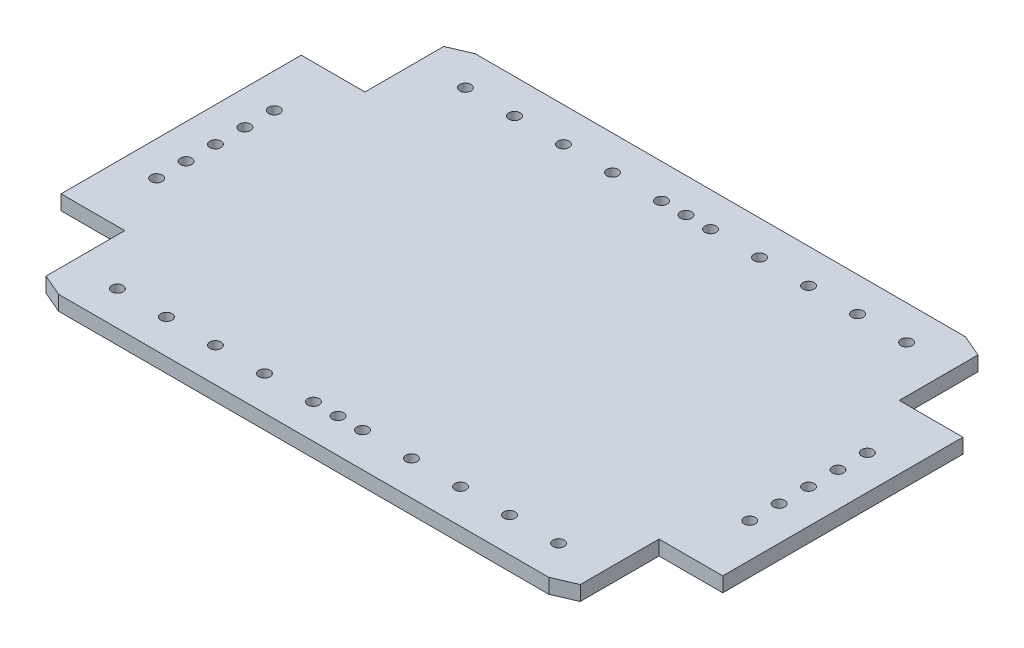
from build123d import *

# Parameters (mm, degrees)
BOSS_EXTRU_1_DEPTH       = 6
ENL_V_MAT_EXTRU_6_REACH  = 161.643
ESQUISSE15_R             = 2.3
ENL_V_MAT_EXTRU_7_REACH  = 161.643
ESQUISSE17_R             = 2.3
ENL_V_MAT_EXTRU_10_REACH = 161.643
SYM_TRIE8_COPY_1_REACH   = 161.643
ENL_V_MAT_EXTRU_11_REACH = 161.643
ESQUISSE21_R             = 2.3


with BuildPart() as part:
    # Esquisse1 → Boss.-Extru.1 (new body)
    with BuildSketch(Plane(origin=(0, 0, 0), x_dir=(1, 0, 0), z_dir=(0, 1, 0))):
        Polygon((-135, 0), (-135, -70), (-100, -85), (0, -85), (100, -85), (135, -70), (135, 0), (135, 70), (100, 85), (0, 85), (-100, 85), (-135, 70), align=None)
    extrude(amount=BOSS_EXTRU_1_DEPTH)

    # Esquisse15 → Enlèv. mat.-Extru.6 (cut, up to next)
    with BuildSketch(Plane(origin=(0, 6, 0), x_dir=(1, 0, 0), z_dir=(0, 1, 0)), mode=Mode.PRIVATE) as enl_v_mat_extru_6_sk1:
        with Locations(Location((-120, -60, 0), (0, 0, 270))):
            Circle(ESQUISSE15_R)
    enl_v_mat_extru_6_tool1 = extrude(enl_v_mat_extru_6_sk1.sketch, amount=-ENL_V_MAT_EXTRU_6_REACH, mode=Mode.PRIVATE) & part.part
    # Esquisse15 → Enlèv. mat.-Extru.6 (cut, up to next)
    with BuildSketch(Plane(origin=(0, 6, 0), x_dir=(1, 0, 0), z_dir=(0, 1, 0)), mode=Mode.PRIVATE) as enl_v_mat_extru_6_sk2:
        with Locations(Location((-120, 60, 0), (0, 0, 270))):
            Circle(ESQUISSE15_R)
    enl_v_mat_extru_6_tool2 = extrude(enl_v_mat_extru_6_sk2.sketch, amount=-ENL_V_MAT_EXTRU_6_REACH, mode=Mode.PRIVATE) & part.part
    enl_v_mat_extru_6_1 = enl_v_mat_extru_6_tool1.solids().sort_by_distance((-120, 6, 60))[0]
    add(enl_v_mat_extru_6_1, mode=Mode.SUBTRACT)
    enl_v_mat_extru_6_2 = enl_v_mat_extru_6_tool2.solids().sort_by_distance((-120, 6, -60))[0]
    add(enl_v_mat_extru_6_2, mode=Mode.SUBTRACT)
    enl_v_mat_extru_6 = enl_v_mat_extru_6_1 + enl_v_mat_extru_6_2  # Enlèv. mat.-Extru.6 as one shape, for the pattern or mirror that repeats it

    # Symétrie5: Enlèv. mat.-Extru.6 across plane
    add(enl_v_mat_extru_6.mirror(Plane(origin=(0, 0, 0), x_dir=(0, 0, 1), z_dir=(1, 0, 0))), mode=Mode.SUBTRACT)

    # Esquisse17 → Enlèv. mat.-Extru.7 (cut, up to next)
    with BuildSketch(Plane(origin=(0, 6, 0), x_dir=(1, 0, 0), z_dir=(0, 1, 0)), mode=Mode.PRIVATE) as enl_v_mat_extru_7_sk1:
        with Locations(Location((0, -71, 0), (0, 0, 270))):
            Circle(ESQUISSE17_R)
    enl_v_mat_extru_7_tool1 = extrude(enl_v_mat_extru_7_sk1.sketch, amount=-ENL_V_MAT_EXTRU_7_REACH, mode=Mode.PRIVATE) & part.part
    # Esquisse17 → Enlèv. mat.-Extru.7 (cut, up to next)
    with BuildSketch(Plane(origin=(0, 6, 0), x_dir=(1, 0, 0), z_dir=(0, 1, 0)), mode=Mode.PRIVATE) as enl_v_mat_extru_7_sk2:
        with Locations(Location((10, -71, 0), (0, 0, 270))):
            Circle(ESQUISSE17_R)
    enl_v_mat_extru_7_tool2 = extrude(enl_v_mat_extru_7_sk2.sketch, amount=-ENL_V_MAT_EXTRU_7_REACH, mode=Mode.PRIVATE) & part.part
    # Esquisse17 → Enlèv. mat.-Extru.7 (cut, up to next)
    with BuildSketch(Plane(origin=(0, 6, 0), x_dir=(1, 0, 0), z_dir=(0, 1, 0)), mode=Mode.PRIVATE) as enl_v_mat_extru_7_sk3:
        with Locations(Location((-10, -71, 0), (0, 0, 270))):
            Circle(ESQUISSE17_R)
    enl_v_mat_extru_7_tool3 = extrude(enl_v_mat_extru_7_sk3.sketch, amount=-ENL_V_MAT_EXTRU_7_REACH, mode=Mode.PRIVATE) & part.part
    # Esquisse17 → Enlèv. mat.-Extru.7 (cut, up to next)
    with BuildSketch(Plane(origin=(0, 6, 0), x_dir=(1, 0, 0), z_dir=(0, 1, 0)), mode=Mode.PRIVATE) as enl_v_mat_extru_7_sk4:
        with Locations(Location((30, -71, 0), (0, 0, 270))):
            Circle(ESQUISSE17_R)
    enl_v_mat_extru_7_tool4 = extrude(enl_v_mat_extru_7_sk4.sketch, amount=-ENL_V_MAT_EXTRU_7_REACH, mode=Mode.PRIVATE) & part.part
    # Esquisse17 → Enlèv. mat.-Extru.7 (cut, up to next)
    with BuildSketch(Plane(origin=(0, 6, 0), x_dir=(1, 0, 0), z_dir=(0, 1, 0)), mode=Mode.PRIVATE) as enl_v_mat_extru_7_sk5:
        with Locations(Location((50, -71, 0), (0, 0, 270))):
            Circle(ESQUISSE17_R)
    enl_v_mat_extru_7_tool5 = extrude(enl_v_mat_extru_7_sk5.sketch, amount=-ENL_V_MAT_EXTRU_7_REACH, mode=Mode.PRIVATE) & part.part
    # Esquisse17 → Enlèv. mat.-Extru.7 (cut, up to next)
    with BuildSketch(Plane(origin=(0, 6, 0), x_dir=(1, 0, 0), z_dir=(0, 1, 0)), mode=Mode.PRIVATE) as enl_v_mat_extru_7_sk6:
        with Locations(Location((90, -71, 0), (0, 0, 270))):
            Circle(ESQUISSE17_R)
    enl_v_mat_extru_7_tool6 = extrude(enl_v_mat_extru_7_sk6.sketch, amount=-ENL_V_MAT_EXTRU_7_REACH, mode=Mode.PRIVATE) & part.part
    # Esquisse17 → Enlèv. mat.-Extru.7 (cut, up to next)
    with BuildSketch(Plane(origin=(0, 6, 0), x_dir=(1, 0, 0), z_dir=(0, 1, 0)), mode=Mode.PRIVATE) as enl_v_mat_extru_7_sk7:
        with Locations(Location((-50, -71, 0), (0, 0, 270))):
            Circle(ESQUISSE17_R)
    enl_v_mat_extru_7_tool7 = extrude(enl_v_mat_extru_7_sk7.sketch, amount=-ENL_V_MAT_EXTRU_7_REACH, mode=Mode.PRIVATE) & part.part
    # Esquisse17 → Enlèv. mat.-Extru.7 (cut, up to next)
    with BuildSketch(Plane(origin=(0, 6, 0), x_dir=(1, 0, 0), z_dir=(0, 1, 0)), mode=Mode.PRIVATE) as enl_v_mat_extru_7_sk8:
        with Locations(Location((-90, -71, 0), (0, 0, 270))):
            Circle(ESQUISSE17_R)
    enl_v_mat_extru_7_tool8 = extrude(enl_v_mat_extru_7_sk8.sketch, amount=-ENL_V_MAT_EXTRU_7_REACH, mode=Mode.PRIVATE) & part.part
    # Esquisse17 → Enlèv. mat.-Extru.7 (cut, up to next)
    with BuildSketch(Plane(origin=(0, 6, 0), x_dir=(1, 0, 0), z_dir=(0, 1, 0)), mode=Mode.PRIVATE) as enl_v_mat_extru_7_sk9:
        with Locations(Location((-90, 71, 0), (0, 0, 270))):
            Circle(ESQUISSE17_R)
    enl_v_mat_extru_7_tool9 = extrude(enl_v_mat_extru_7_sk9.sketch, amount=-ENL_V_MAT_EXTRU_7_REACH, mode=Mode.PRIVATE) & part.part
    # Esquisse17 → Enlèv. mat.-Extru.7 (cut, up to next)
    with BuildSketch(Plane(origin=(0, 6, 0), x_dir=(1, 0, 0), z_dir=(0, 1, 0)), mode=Mode.PRIVATE) as enl_v_mat_extru_7_sk10:
        with Locations(Location((-50, 71, 0), (0, 0, 270))):
            Circle(ESQUISSE17_R)
    enl_v_mat_extru_7_tool10 = extrude(enl_v_mat_extru_7_sk10.sketch, amount=-ENL_V_MAT_EXTRU_7_REACH, mode=Mode.PRIVATE) & part.part
    # Esquisse17 → Enlèv. mat.-Extru.7 (cut, up to next)
    with BuildSketch(Plane(origin=(0, 6, 0), x_dir=(1, 0, 0), z_dir=(0, 1, 0)), mode=Mode.PRIVATE) as enl_v_mat_extru_7_sk11:
        with Locations(Location((-30, 71, 0), (0, 0, 270))):
            Circle(ESQUISSE17_R)
    enl_v_mat_extru_7_tool11 = extrude(enl_v_mat_extru_7_sk11.sketch, amount=-ENL_V_MAT_EXTRU_7_REACH, mode=Mode.PRIVATE) & part.part
    # Esquisse17 → Enlèv. mat.-Extru.7 (cut, up to next)
    with BuildSketch(Plane(origin=(0, 6, 0), x_dir=(1, 0, 0), z_dir=(0, 1, 0)), mode=Mode.PRIVATE) as enl_v_mat_extru_7_sk12:
        with Locations(Location((90, 71, 0), (0, 0, 270))):
            Circle(ESQUISSE17_R)
    enl_v_mat_extru_7_tool12 = extrude(enl_v_mat_extru_7_sk12.sketch, amount=-ENL_V_MAT_EXTRU_7_REACH, mode=Mode.PRIVATE) & part.part
    # Esquisse17 → Enlèv. mat.-Extru.7 (cut, up to next)
    with BuildSketch(Plane(origin=(0, 6, 0), x_dir=(1, 0, 0), z_dir=(0, 1, 0)), mode=Mode.PRIVATE) as enl_v_mat_extru_7_sk13:
        with Locations(Location((50, 71, 0), (0, 0, 270))):
            Circle(ESQUISSE17_R)
    enl_v_mat_extru_7_tool13 = extrude(enl_v_mat_extru_7_sk13.sketch, amount=-ENL_V_MAT_EXTRU_7_REACH, mode=Mode.PRIVATE) & part.part
    # Esquisse17 → Enlèv. mat.-Extru.7 (cut, up to next)
    with BuildSketch(Plane(origin=(0, 6, 0), x_dir=(1, 0, 0), z_dir=(0, 1, 0)), mode=Mode.PRIVATE) as enl_v_mat_extru_7_sk14:
        with Locations(Location((30, 71, 0), (0, 0, 270))):
            Circle(ESQUISSE17_R)
    enl_v_mat_extru_7_tool14 = extrude(enl_v_mat_extru_7_sk14.sketch, amount=-ENL_V_MAT_EXTRU_7_REACH, mode=Mode.PRIVATE) & part.part
    # Esquisse17 → Enlèv. mat.-Extru.7 (cut, up to next)
    with BuildSketch(Plane(origin=(0, 6, 0), x_dir=(1, 0, 0), z_dir=(0, 1, 0)), mode=Mode.PRIVATE) as enl_v_mat_extru_7_sk15:
        with Locations(Location((-10, 71, 0), (0, 0, 270))):
            Circle(ESQUISSE17_R)
    enl_v_mat_extru_7_tool15 = extrude(enl_v_mat_extru_7_sk15.sketch, amount=-ENL_V_MAT_EXTRU_7_REACH, mode=Mode.PRIVATE) & part.part
    # Esquisse17 → Enlèv. mat.-Extru.7 (cut, up to next)
    with BuildSketch(Plane(origin=(0, 6, 0), x_dir=(1, 0, 0), z_dir=(0, 1, 0)), mode=Mode.PRIVATE) as enl_v_mat_extru_7_sk16:
        with Locations(Location((10, 71, 0), (0, 0, 270))):
            Circle(ESQUISSE17_R)
    enl_v_mat_extru_7_tool16 = extrude(enl_v_mat_extru_7_sk16.sketch, amount=-ENL_V_MAT_EXTRU_7_REACH, mode=Mode.PRIVATE) & part.part
    # Esquisse17 → Enlèv. mat.-Extru.7 (cut, up to next)
    with BuildSketch(Plane(origin=(0, 6, 0), x_dir=(1, 0, 0), z_dir=(0, 1, 0)), mode=Mode.PRIVATE) as enl_v_mat_extru_7_sk17:
        with Locations(Location((0, 71, 0), (0, 0, 270))):
            Circle(ESQUISSE17_R)
    enl_v_mat_extru_7_tool17 = extrude(enl_v_mat_extru_7_sk17.sketch, amount=-ENL_V_MAT_EXTRU_7_REACH, mode=Mode.PRIVATE) & part.part
    # Esquisse17 → Enlèv. mat.-Extru.7 (cut, up to next)
    with BuildSketch(Plane(origin=(0, 6, 0), x_dir=(1, 0, 0), z_dir=(0, 1, 0)), mode=Mode.PRIVATE) as enl_v_mat_extru_7_sk18:
        with Locations(Location((-70, -71, 0), (0, 0, 270))):
            Circle(ESQUISSE17_R)
    enl_v_mat_extru_7_tool18 = extrude(enl_v_mat_extru_7_sk18.sketch, amount=-ENL_V_MAT_EXTRU_7_REACH, mode=Mode.PRIVATE) & part.part
    # Esquisse17 → Enlèv. mat.-Extru.7 (cut, up to next)
    with BuildSketch(Plane(origin=(0, 6, 0), x_dir=(1, 0, 0), z_dir=(0, 1, 0)), mode=Mode.PRIVATE) as enl_v_mat_extru_7_sk19:
        with Locations(Location((-30, -71, 0), (0, 0, 270))):
            Circle(ESQUISSE17_R)
    enl_v_mat_extru_7_tool19 = extrude(enl_v_mat_extru_7_sk19.sketch, amount=-ENL_V_MAT_EXTRU_7_REACH, mode=Mode.PRIVATE) & part.part
    # Esquisse17 → Enlèv. mat.-Extru.7 (cut, up to next)
    with BuildSketch(Plane(origin=(0, 6, 0), x_dir=(1, 0, 0), z_dir=(0, 1, 0)), mode=Mode.PRIVATE) as enl_v_mat_extru_7_sk20:
        with Locations(Location((70, -71, 0), (0, 0, 270))):
            Circle(ESQUISSE17_R)
    enl_v_mat_extru_7_tool20 = extrude(enl_v_mat_extru_7_sk20.sketch, amount=-ENL_V_MAT_EXTRU_7_REACH, mode=Mode.PRIVATE) & part.part
    # Esquisse17 → Enlèv. mat.-Extru.7 (cut, up to next)
    with BuildSketch(Plane(origin=(0, 6, 0), x_dir=(1, 0, 0), z_dir=(0, 1, 0)), mode=Mode.PRIVATE) as enl_v_mat_extru_7_sk21:
        with Locations(Location((70, 71, 0), (0, 0, 270))):
            Circle(ESQUISSE17_R)
    enl_v_mat_extru_7_tool21 = extrude(enl_v_mat_extru_7_sk21.sketch, amount=-ENL_V_MAT_EXTRU_7_REACH, mode=Mode.PRIVATE) & part.part
    # Esquisse17 → Enlèv. mat.-Extru.7 (cut, up to next)
    with BuildSketch(Plane(origin=(0, 6, 0), x_dir=(1, 0, 0), z_dir=(0, 1, 0)), mode=Mode.PRIVATE) as enl_v_mat_extru_7_sk22:
        with Locations(Location((-70, 71, 0), (0, 0, 270))):
            Circle(ESQUISSE17_R)
    enl_v_mat_extru_7_tool22 = extrude(enl_v_mat_extru_7_sk22.sketch, amount=-ENL_V_MAT_EXTRU_7_REACH, mode=Mode.PRIVATE) & part.part
    add(enl_v_mat_extru_7_tool1.solids().sort_by_distance((0, 6, 71))[0], mode=Mode.SUBTRACT)
    add(enl_v_mat_extru_7_tool2.solids().sort_by_distance((10, 6, 71))[0], mode=Mode.SUBTRACT)
    add(enl_v_mat_extru_7_tool3.solids().sort_by_distance((-10, 6, 71))[0], mode=Mode.SUBTRACT)
    add(enl_v_mat_extru_7_tool4.solids().sort_by_distance((30, 6, 71))[0], mode=Mode.SUBTRACT)
    add(enl_v_mat_extru_7_tool5.solids().sort_by_distance((50, 6, 71))[0], mode=Mode.SUBTRACT)
    add(enl_v_mat_extru_7_tool6.solids().sort_by_distance((90, 6, 71))[0], mode=Mode.SUBTRACT)
    add(enl_v_mat_extru_7_tool7.solids().sort_by_distance((-50, 6, 71))[0], mode=Mode.SUBTRACT)
    add(enl_v_mat_extru_7_tool8.solids().sort_by_distance((-90, 6, 71))[0], mode=Mode.SUBTRACT)
    add(enl_v_mat_extru_7_tool9.solids().sort_by_distance((-90, 6, -71))[0], mode=Mode.SUBTRACT)
    add(enl_v_mat_extru_7_tool10.solids().sort_by_distance((-50, 6, -71))[0], mode=Mode.SUBTRACT)
    add(enl_v_mat_extru_7_tool11.solids().sort_by_distance((-30, 6, -71))[0], mode=Mode.SUBTRACT)
    add(enl_v_mat_extru_7_tool12.solids().sort_by_distance((90, 6, -71))[0], mode=Mode.SUBTRACT)
    add(enl_v_mat_extru_7_tool13.solids().sort_by_distance((50, 6, -71))[0], mode=Mode.SUBTRACT)
    add(enl_v_mat_extru_7_tool14.solids().sort_by_distance((30, 6, -71))[0], mode=Mode.SUBTRACT)
    add(enl_v_mat_extru_7_tool15.solids().sort_by_distance((-10, 6, -71))[0], mode=Mode.SUBTRACT)
    add(enl_v_mat_extru_7_tool16.solids().sort_by_distance((10, 6, -71))[0], mode=Mode.SUBTRACT)
    add(enl_v_mat_extru_7_tool17.solids().sort_by_distance((0, 6, -71))[0], mode=Mode.SUBTRACT)
    add(enl_v_mat_extru_7_tool18.solids().sort_by_distance((-70, 6, 71))[0], mode=Mode.SUBTRACT)
    add(enl_v_mat_extru_7_tool19.solids().sort_by_distance((-30, 6, 71))[0], mode=Mode.SUBTRACT)
    add(enl_v_mat_extru_7_tool20.solids().sort_by_distance((70, 6, 71))[0], mode=Mode.SUBTRACT)
    add(enl_v_mat_extru_7_tool21.solids().sort_by_distance((70, 6, -71))[0], mode=Mode.SUBTRACT)
    add(enl_v_mat_extru_7_tool22.solids().sort_by_distance((-70, 6, -71))[0], mode=Mode.SUBTRACT)

    # Esquisse20 → Enlèv. mat.-Extru.10 (cut, up to next)
    with BuildSketch(Plane(origin=(0, 6, 0), x_dir=(1, 0, 0), z_dir=(0, 1, 0)), mode=Mode.PRIVATE) as enl_v_mat_extru_10_sk1:
        Polygon((-109, -60), (-109, -81.142857143), (-135, -70.571428571), (-135, -49), (-109, -49), align=None)
    enl_v_mat_extru_10_tool1 = extrude(enl_v_mat_extru_10_sk1.sketch, amount=-ENL_V_MAT_EXTRU_10_REACH, mode=Mode.PRIVATE) & part.part
    enl_v_mat_extru_10 = enl_v_mat_extru_10_tool1.solids().sort_by_distance((-121.147163, 6, 62.60195))[0]
    add(enl_v_mat_extru_10, mode=Mode.SUBTRACT)

    # Symétrie7: Enlèv. mat.-Extru.10 across plane
    add(enl_v_mat_extru_10.mirror(Plane(origin=(0, 0, 0), x_dir=(0, 0, 1), z_dir=(1, 0, 0))), mode=Mode.SUBTRACT)

    # Symétrie8: Enlèv. mat.-Extru.10 across plane
    add(enl_v_mat_extru_10.mirror(Plane.XY), mode=Mode.SUBTRACT)

    # Symétrie8 copy 1 sketch → Symétrie8 copy 1 (cut, up to next)
    with BuildSketch(Plane(origin=(0, 6, 0), x_dir=(-1, 0, 0), z_dir=(0, 1, 0)), mode=Mode.PRIVATE) as sym_trie8_copy_1_sk1:
        Polygon((-109, -60), (-109, -81.142857143), (-135, -70.571428571), (-135, -49), (-109, -49), align=None)
    sym_trie8_copy_1_tool1 = extrude(sym_trie8_copy_1_sk1.sketch, amount=-SYM_TRIE8_COPY_1_REACH, mode=Mode.PRIVATE) & part.part
    add(sym_trie8_copy_1_tool1.solids().sort_by_distance((121.147163, 6, -62.60195))[0], mode=Mode.SUBTRACT)

    # Esquisse21 → Enlèv. mat.-Extru.11 (cut, up to next)
    with BuildSketch(Plane(origin=(0, 6, 0), x_dir=(1, 0, 0), z_dir=(0, 1, 0)), mode=Mode.PRIVATE) as enl_v_mat_extru_11_sk1:
        with Locations(Location((-121, 24, 0), (0, 0, 270))):
            Circle(ESQUISSE21_R)
    enl_v_mat_extru_11_tool1 = extrude(enl_v_mat_extru_11_sk1.sketch, amount=-ENL_V_MAT_EXTRU_11_REACH, mode=Mode.PRIVATE) & part.part
    # Esquisse21 → Enlèv. mat.-Extru.11 (cut, up to next)
    with BuildSketch(Plane(origin=(0, 6, 0), x_dir=(1, 0, 0), z_dir=(0, 1, 0)), mode=Mode.PRIVATE) as enl_v_mat_extru_11_sk2:
        with Locations(Location((-121, 12, 0), (0, 0, 270))):
            Circle(ESQUISSE21_R)
    enl_v_mat_extru_11_tool2 = extrude(enl_v_mat_extru_11_sk2.sketch, amount=-ENL_V_MAT_EXTRU_11_REACH, mode=Mode.PRIVATE) & part.part
    # Esquisse21 → Enlèv. mat.-Extru.11 (cut, up to next)
    with BuildSketch(Plane(origin=(0, 6, 0), x_dir=(1, 0, 0), z_dir=(0, 1, 0)), mode=Mode.PRIVATE) as enl_v_mat_extru_11_sk3:
        with Locations(Location((-121, -24, 0), (0, 0, 270))):
            Circle(ESQUISSE21_R)
    enl_v_mat_extru_11_tool3 = extrude(enl_v_mat_extru_11_sk3.sketch, amount=-ENL_V_MAT_EXTRU_11_REACH, mode=Mode.PRIVATE) & part.part
    # Esquisse21 → Enlèv. mat.-Extru.11 (cut, up to next)
    with BuildSketch(Plane(origin=(0, 6, 0), x_dir=(1, 0, 0), z_dir=(0, 1, 0)), mode=Mode.PRIVATE) as enl_v_mat_extru_11_sk4:
        with Locations(Location((-121, -12, 0), (0, 0, 270))):
            Circle(ESQUISSE21_R)
    enl_v_mat_extru_11_tool4 = extrude(enl_v_mat_extru_11_sk4.sketch, amount=-ENL_V_MAT_EXTRU_11_REACH, mode=Mode.PRIVATE) & part.part
    # Esquisse21 → Enlèv. mat.-Extru.11 (cut, up to next)
    with BuildSketch(Plane(origin=(0, 6, 0), x_dir=(1, 0, 0), z_dir=(0, 1, 0)), mode=Mode.PRIVATE) as enl_v_mat_extru_11_sk5:
        with Locations(Location((-121, 0, 0), (0, 0, 270))):
            Circle(ESQUISSE21_R)
    enl_v_mat_extru_11_tool5 = extrude(enl_v_mat_extru_11_sk5.sketch, amount=-ENL_V_MAT_EXTRU_11_REACH, mode=Mode.PRIVATE) & part.part
    # Esquisse21 → Enlèv. mat.-Extru.11 (cut, up to next)
    with BuildSketch(Plane(origin=(0, 6, 0), x_dir=(1, 0, 0), z_dir=(0, 1, 0)), mode=Mode.PRIVATE) as enl_v_mat_extru_11_sk6:
        with Locations(Location((121, 0, 0), (0, 0, 270))):
            Circle(ESQUISSE21_R)
    enl_v_mat_extru_11_tool6 = extrude(enl_v_mat_extru_11_sk6.sketch, amount=-ENL_V_MAT_EXTRU_11_REACH, mode=Mode.PRIVATE) & part.part
    # Esquisse21 → Enlèv. mat.-Extru.11 (cut, up to next)
    with BuildSketch(Plane(origin=(0, 6, 0), x_dir=(1, 0, 0), z_dir=(0, 1, 0)), mode=Mode.PRIVATE) as enl_v_mat_extru_11_sk7:
        with Locations(Location((121, -12, 0), (0, 0, 270))):
            Circle(ESQUISSE21_R)
    enl_v_mat_extru_11_tool7 = extrude(enl_v_mat_extru_11_sk7.sketch, amount=-ENL_V_MAT_EXTRU_11_REACH, mode=Mode.PRIVATE) & part.part
    # Esquisse21 → Enlèv. mat.-Extru.11 (cut, up to next)
    with BuildSketch(Plane(origin=(0, 6, 0), x_dir=(1, 0, 0), z_dir=(0, 1, 0)), mode=Mode.PRIVATE) as enl_v_mat_extru_11_sk8:
        with Locations(Location((121, -24, 0), (0, 0, 270))):
            Circle(ESQUISSE21_R)
    enl_v_mat_extru_11_tool8 = extrude(enl_v_mat_extru_11_sk8.sketch, amount=-ENL_V_MAT_EXTRU_11_REACH, mode=Mode.PRIVATE) & part.part
    # Esquisse21 → Enlèv. mat.-Extru.11 (cut, up to next)
    with BuildSketch(Plane(origin=(0, 6, 0), x_dir=(1, 0, 0), z_dir=(0, 1, 0)), mode=Mode.PRIVATE) as enl_v_mat_extru_11_sk9:
        with Locations(Location((121, 12, 0), (0, 0, 270))):
            Circle(ESQUISSE21_R)
    enl_v_mat_extru_11_tool9 = extrude(enl_v_mat_extru_11_sk9.sketch, amount=-ENL_V_MAT_EXTRU_11_REACH, mode=Mode.PRIVATE) & part.part
    # Esquisse21 → Enlèv. mat.-Extru.11 (cut, up to next)
    with BuildSketch(Plane(origin=(0, 6, 0), x_dir=(1, 0, 0), z_dir=(0, 1, 0)), mode=Mode.PRIVATE) as enl_v_mat_extru_11_sk10:
        with Locations(Location((121, 24, 0), (0, 0, 270))):
            Circle(ESQUISSE21_R)
    enl_v_mat_extru_11_tool10 = extrude(enl_v_mat_extru_11_sk10.sketch, amount=-ENL_V_MAT_EXTRU_11_REACH, mode=Mode.PRIVATE) & part.part
    add(enl_v_mat_extru_11_tool1.solids().sort_by_distance((-121, 6, -24))[0], mode=Mode.SUBTRACT)
    add(enl_v_mat_extru_11_tool2.solids().sort_by_distance((-121, 6, -12))[0], mode=Mode.SUBTRACT)
    add(enl_v_mat_extru_11_tool3.solids().sort_by_distance((-121, 6, 24))[0], mode=Mode.SUBTRACT)
    add(enl_v_mat_extru_11_tool4.solids().sort_by_distance((-121, 6, 12))[0], mode=Mode.SUBTRACT)
    add(enl_v_mat_extru_11_tool5.solids().sort_by_distance((-121, 6, 0))[0], mode=Mode.SUBTRACT)
    add(enl_v_mat_extru_11_tool6.solids().sort_by_distance((121, 6, 0))[0], mode=Mode.SUBTRACT)
    add(enl_v_mat_extru_11_tool7.solids().sort_by_distance((121, 6, 12))[0], mode=Mode.SUBTRACT)
    add(enl_v_mat_extru_11_tool8.solids().sort_by_distance((121, 6, 24))[0], mode=Mode.SUBTRACT)
    add(enl_v_mat_extru_11_tool9.solids().sort_by_distance((121, 6, -12))[0], mode=Mode.SUBTRACT)
    add(enl_v_mat_extru_11_tool10.solids().sort_by_distance((121, 6, -24))[0], mode=Mode.SUBTRACT)


solid = part.part
